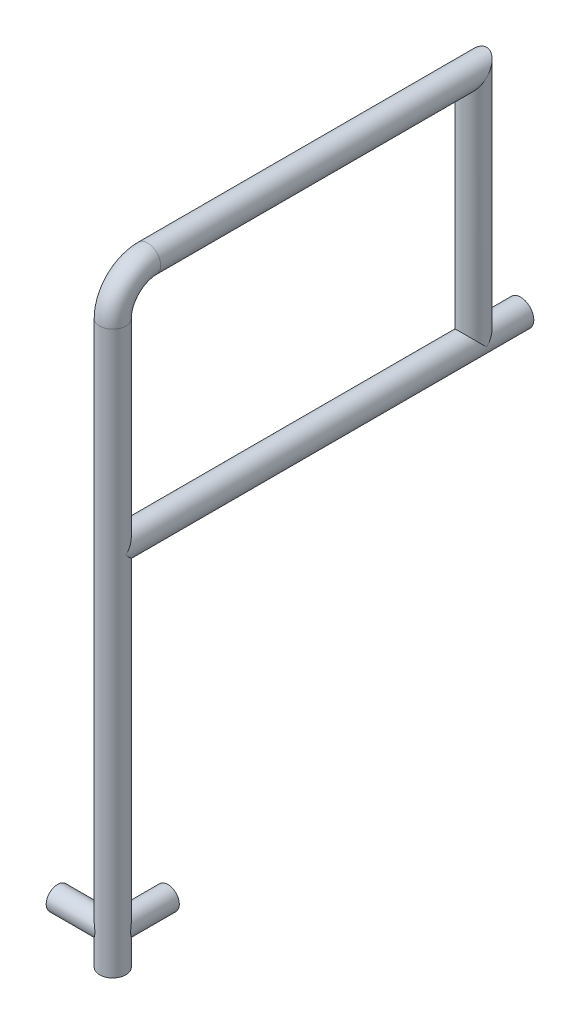
from build123d import *

# Parameters (mm, degrees)
SKETCH2_R           = 20
SKETCH4_R           = 20
BOSS_EXTRUDE1_DEPTH = 553.90605298
SKETCH5_R           = 20
BOSS_EXTRUDE2_DEPTH = 622
SKETCH6_R           = 17.5
CUT_EXTRUDE1_DEPTH  = 199
SKETCH7_R           = 17.5
BOSS_EXTRUDE3_DEPTH = 84
SKETCH9_R           = 17.5
BOSS_EXTRUDE4_DEPTH = 84


with BuildPart() as part:
    # Sweep1: sweep along a path in Sketch3
    with BuildLine(Plane(origin=(0, 0, 0), x_dir=(0, 0, -1), z_dir=(1, 0, 0))) as sweep1_path:
        Line((0, 0), (0, 302.819820908))
        ThreePointArc((0, 302.819820908), (15.565663847, 340.398657675), (53.144500614, 355.964321522))
        Line((53.144500614, 355.964321522), (550.094321522, 355.964321522))
        Line((550.094321522, 355.964321522), (550.094321522, 0.094321522))
    # Sketch2 → Sweep1 (sweep)
    with BuildSketch(Plane(origin=(0, 0, 0), x_dir=(1, 0, 0), z_dir=(0, 1, 0))):
        Circle(SKETCH2_R)
    sweep(path=sweep1_path.line, transition=Transition.RIGHT)

    # Sketch4 → Boss-Extrude1 (add)
    with BuildSketch(Plane.XZ):
        with Locations(Location((0, 0, 0), (0, 0, 90))):
            Circle(SKETCH4_R)
    extrude(amount=BOSS_EXTRUDE1_DEPTH)

    # Sketch5 → Boss-Extrude2 (add)
    with BuildSketch(Plane.XY):
        Circle(SKETCH5_R)
    extrude(amount=-BOSS_EXTRUDE2_DEPTH)

    # Sketch6 → Cut-Extrude1 (cut)
    with BuildSketch(Plane(origin=(0, 0, -622), x_dir=(-1, 0, 0), z_dir=(0, 0, -1))):
        Circle(SKETCH6_R)
    extrude(amount=-CUT_EXTRUDE1_DEPTH, mode=Mode.SUBTRACT)

    # Sketch7 → Boss-Extrude3 (add)
    with BuildSketch(Plane.XY):
        with Locations((0, -503.90605298)):
            Circle(SKETCH7_R)
    extrude(amount=-BOSS_EXTRUDE3_DEPTH)

    # Sketch9 → Boss-Extrude4 (add)
    with BuildSketch(Plane(origin=(0, 0, 0), x_dir=(0, 0, -1), z_dir=(1, 0, 0))):
        with Locations((0, -503.90605298)):
            Circle(SKETCH9_R)
    extrude(amount=-BOSS_EXTRUDE4_DEPTH)


solid = part.part
